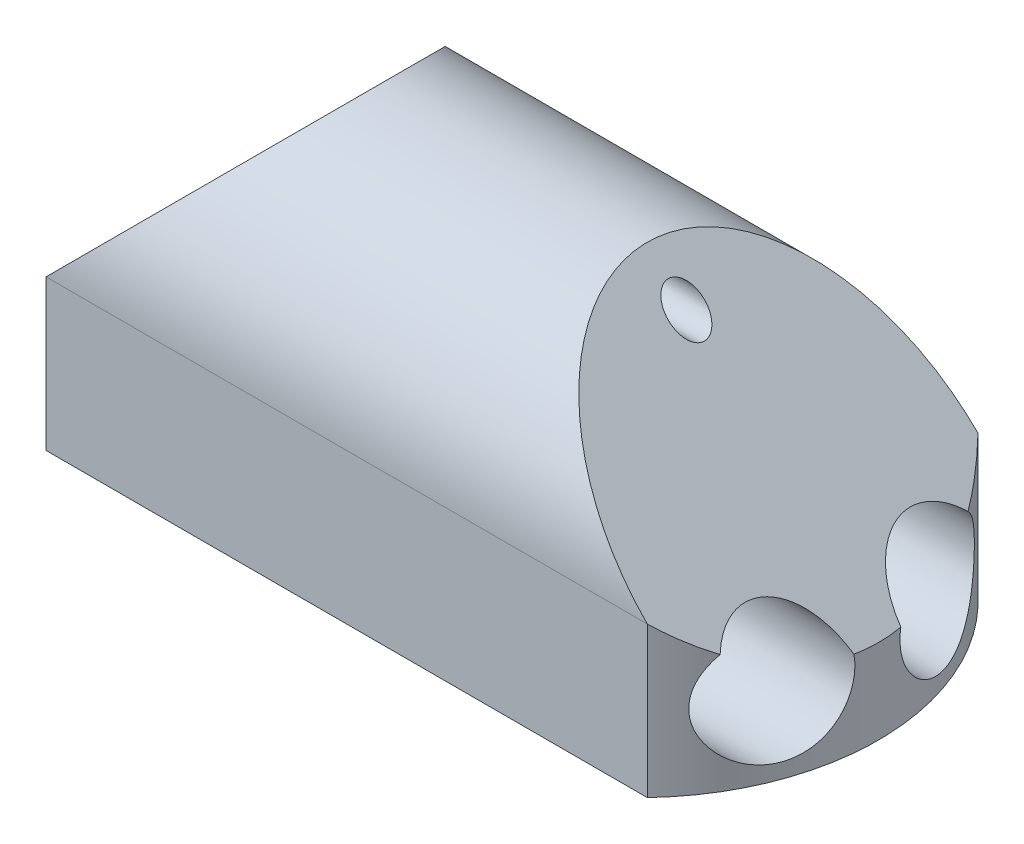
from build123d import *
from build123d.topology import SkipClean

# Parameters (mm, degrees)
SKETCH1_W                             = 25.4
SKETCH1_H                             = 13.97
DEPTH_A_DEPTH                         = 6.35
ROUND_EXTRUDE_DEPTH                   = 25.4
ANGLE_CUT_DEPTH                       = 32.908355097
STRING_HOLE_R                         = 0.762
STRING_HOLE_CUT_DEPTH                 = 32.908355097
ELASTIC_HOLE_CUT_DEPTH                = 32.908355097
ELASTIC_HOLE_CUT_DEPTH_BACK           = 32.908355097
ELASTIC_HOLES_R                       = 2.54
GUIDE_OUTIE_EXTRUDE_REACH             = 33.908
SKETCH7_R                             = 2.54
ELASTIC_HOLE_CUT_ON_GUIDE_OUTIE_DEPTH = 32.908355097
GUIDE_INNIE_CUT_DEPTH                 = 32.908355141


with BuildPart() as part:
    # Sketch1 → depth a (new body)
    with BuildSketch(Plane(origin=(0, 0, 0), x_dir=(1, 0, 0), z_dir=(0, 1, 0))):
        with Locations((-12.7, 6.985)):
            Rectangle(SKETCH1_W, SKETCH1_H)
    extrude(amount=DEPTH_A_DEPTH)

    # Sketch4 → round extrude (add)
    with BuildSketch(Plane(origin=(0, 0, 0), x_dir=(0, 0, -1), z_dir=(1, 0, 0))):
        with BuildLine():
            Line((0, 6.35), (13.97, 6.35))
            ThreePointArc((13.97, 6.35), (6.985, 13.335), (0, 6.35))
        make_face()
    extrude(amount=-ROUND_EXTRUDE_DEPTH)

    # Sketch5 → angle cut (cut, through all)
    with BuildSketch(Plane.XY):
        Polygon((0, 6.35), (0, 13.335), (-6.985, 13.335), align=None)
        Polygon((-25.4, 6.35), (-25.4, 13.335), (-18.415, 13.335), align=None)
    extrude(amount=-ANGLE_CUT_DEPTH, mode=Mode.SUBTRACT)

    # string hole → string hole cut (cut, through all)
    with BuildSketch(Plane(origin=(0, 0, 0), x_dir=(0, 0, -1), z_dir=(1, 0, 0))):
        with Locations(Location((6.985, 11.684, 0), (0, 0, 270))):
            Circle(STRING_HOLE_R)
    extrude(amount=-STRING_HOLE_CUT_DEPTH, mode=Mode.SUBTRACT)

    # elastic holes → elastic hole cut (cut, two sides: drawn at the far end of the back side and taken through both)
    with BuildSketch(Plane(origin=(0, 0, 0), x_dir=(0, 0, -1), z_dir=(1, 0, 0)).offset(-ELASTIC_HOLE_CUT_DEPTH_BACK)):
        with Locations((3.4925, 3.175)):
            Circle(ELASTIC_HOLES_R)
        with Locations(Location((10.4775, 3.175, 0), (0, 0, 180))):
            Circle(ELASTIC_HOLES_R)
    extrude(amount=ELASTIC_HOLE_CUT_DEPTH + ELASTIC_HOLE_CUT_DEPTH_BACK, mode=Mode.SUBTRACT)

    # guide outie extrude: up to this plane
    guide_outie_extrude_end = Plane(origin=(-6.985, 13.335, -13.97), z_dir=(-0.7071067811865512, -0.7071067811865439, 0))
    # guide outie → guide outie extrude (add, up to the surface)
    with BuildSketch(Plane(origin=(0, 0, 0), x_dir=(1, 0, 0), z_dir=(0, 1, 0)), mode=Mode.PRIVATE) as guide_outie_extrude_sk1:
        with BuildLine():
            Line((0, 13.97), (0, 0))
            ThreePointArc((0, 0), (2.781966725, 6.985), (0, 13.97))
        make_face()
    guide_outie_extrude_tool1 = split(extrude(guide_outie_extrude_sk1.sketch, amount=GUIDE_OUTIE_EXTRUDE_REACH, mode=Mode.PRIVATE), bisect_by=guide_outie_extrude_end, keep=Keep.BOTH, mode=Mode.PRIVATE)
    add(guide_outie_extrude_tool1.solids().sort_by_distance((1.126975, 0, -6.985))[0])

    # Sketch7 → elastic hole cut on guide outie (cut, through all)
    with SkipClean():  # the faces are left unmerged after this step: merging them gives an invalid solid
        with BuildSketch(Plane.ZY):
            with Locations(Location((-3.4925, 3.175, 0), (0, 0, 180))):
                Circle(SKETCH7_R)
            with Locations(Location((-10.4775, 3.175, 0), (0, 0, 133.366502627))):
                Circle(SKETCH7_R)
        extrude(amount=-ELASTIC_HOLE_CUT_ON_GUIDE_OUTIE_DEPTH, mode=Mode.SUBTRACT)

    # guide innie → guide innie cut (cut, through all)
    with SkipClean():  # the faces are left unmerged after this step: merging them gives an invalid solid
        with BuildSketch(Plane(origin=(0, 0, 0), x_dir=(1, 0, 0), z_dir=(0, 1, 0))):
            with BuildLine():
                Line((-25.4, 13.97), (-25.4, 0))
                ThreePointArc((-25.4, 0), (-22.618033275, 6.985), (-25.4, 13.97))
            make_face()
        extrude(amount=GUIDE_INNIE_CUT_DEPTH, mode=Mode.SUBTRACT)


solid = part.part
